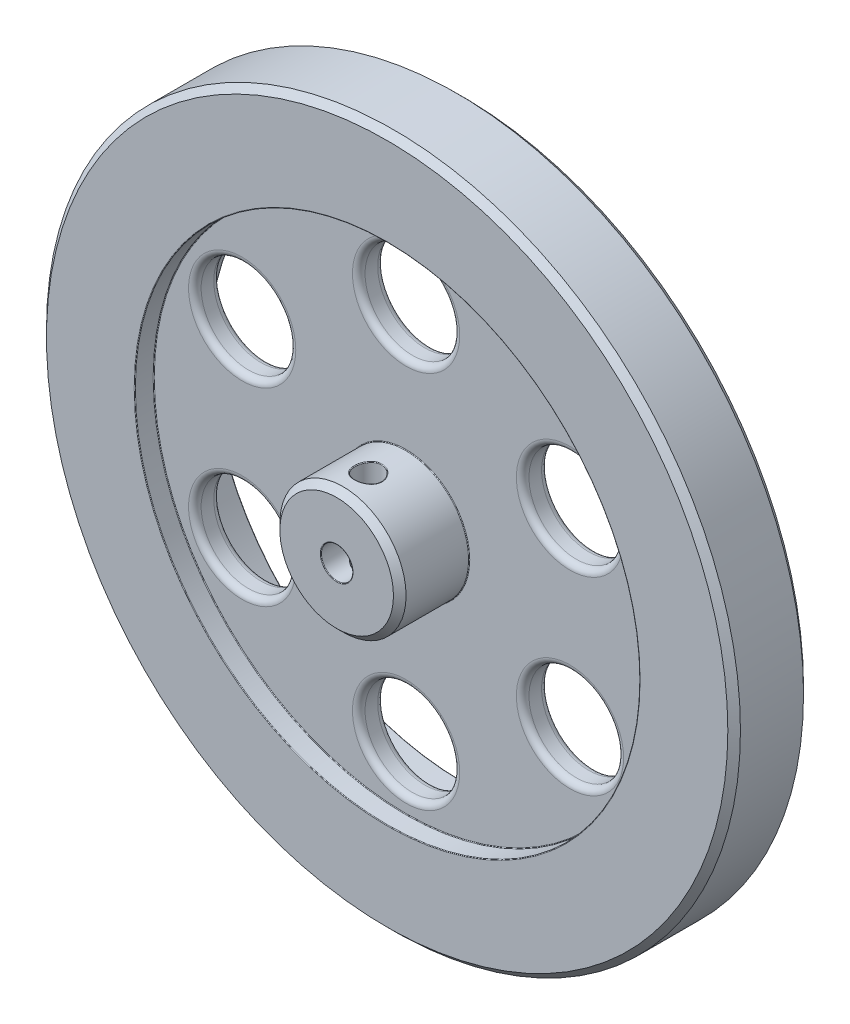
from build123d import *

# Parameters (mm, degrees)
SKETCH1_R           = 55
SKETCH1_R_2         = 40
BOSS_EXTRUDE1_DEPTH = 12
BOSS_EXTRUDE2_START = 5
SKETCH1_3_R         = 40
SKETCH1_3_R_2       = 7.5
SKETCH1_3_R_3       = 10
BOSS_EXTRUDE2_DEPTH = 4
BOSS_EXTRUDE3_START = 5
SKETCH1_4_R         = 10
SKETCH1_4_R_2       = 2.5
BOSS_EXTRUDE3_DEPTH = 15
CHAMFER1_SIZE       = 1
FILLET1_R           = 0.1
FILLET2_R           = 1


with BuildPart() as part:
    # Sketch1 → Boss-Extrude1 (new body)
    with BuildSketch(Plane.XY):
        Circle(SKETCH1_R)
        Circle(SKETCH1_R_2, mode=Mode.SUBTRACT)
    extrude(amount=BOSS_EXTRUDE1_DEPTH)

    # Sketch1<3> → Boss-Extrude2 (add)
    with BuildSketch(Plane.XY.offset(BOSS_EXTRUDE2_START)):
        Circle(SKETCH1_3_R)
        with Locations((-25.980762114, -15)):
            Circle(SKETCH1_3_R_2, mode=Mode.SUBTRACT)
        with Locations((0, -30)):
            Circle(SKETCH1_3_R_2, mode=Mode.SUBTRACT)
        with Locations((25.980762114, -15)):
            Circle(SKETCH1_3_R_2, mode=Mode.SUBTRACT)
        with Locations((-25.980762114, 15)):
            Circle(SKETCH1_3_R_2, mode=Mode.SUBTRACT)
        Circle(SKETCH1_3_R_3, mode=Mode.SUBTRACT)
        with Locations((25.980762114, 15)):
            Circle(SKETCH1_3_R_2, mode=Mode.SUBTRACT)
        with Locations((0, 30)):
            Circle(SKETCH1_3_R_2, mode=Mode.SUBTRACT)
    extrude(amount=BOSS_EXTRUDE2_DEPTH)

    # Sketch1<4> → Boss-Extrude3 (add)
    with BuildSketch(Plane.XY.offset(BOSS_EXTRUDE3_START)):
        Circle(SKETCH1_4_R)
        Circle(SKETCH1_4_R_2, mode=Mode.SUBTRACT)
    extrude(amount=BOSS_EXTRUDE3_DEPTH)

    # Sketch3 → M5x0.8 Tapped Hole1 (revolve, cut)
    with BuildSketch(Plane(origin=(0, 0, 15), x_dir=(0, 0, 1), z_dir=(1, 0, 0))):
        Polygon((0, 0), (0, 11.2618073), (2.1, 10), (2.1, 0), align=None)
    m5x0_8_tapped_hole1 = revolve(axis=Axis((0, 6.35, 15), (0, -1, 0)), mode=Mode.SUBTRACT)

    # Mirror2: M5x0.8 Tapped Hole1 across plane
    add(m5x0_8_tapped_hole1.mirror(Plane.ZX), mode=Mode.SUBTRACT)

    # Chamfer1
    chamfer1_edges = [part.edges().sort_by_distance(p)[0] for p in [
        (-10, 0, 20),
        (-55, 0, 0),
        (-55, 0, 12),
    ]]
    chamfer(chamfer1_edges, length=CHAMFER1_SIZE)

    # Fillet1
    fillet1_edges = [part.edges().sort_by_distance(p)[0] for p in [
        (-40, 0, 0),
        (-40, 0, 5),
        (-40, 0, 9),
        (-40, 0, 12),
        (-1e-09, -9.999999997, 12.899999986),
        (-2.5, 0, 20),
        (-1e-09, 9.999999997, 12.899999986),
        (-10, 0, 9),
    ]]
    fillet(fillet1_edges, radius=FILLET1_R)

    # Fillet2
    fillet2_edges = [part.edges().sort_by_distance(p)[0] for p in [
        (-33.480762114, 15, 5),
        (18.480762114, -15, 5),
        (18.480762114, 15, 5),
        (-7.5, 30, 5),
        (-33.480762114, 15, 9),
        (-33.480762114, -15, 9),
        (-7.5, -30, 9),
        (18.480762114, -15, 9),
        (18.480762114, 15, 9),
        (-7.5, 30, 9),
        (-7.5, -30, 5),
        (-33.480762114, -15, 5),
    ]]
    fillet(fillet2_edges, radius=FILLET2_R)


solid = part.part
